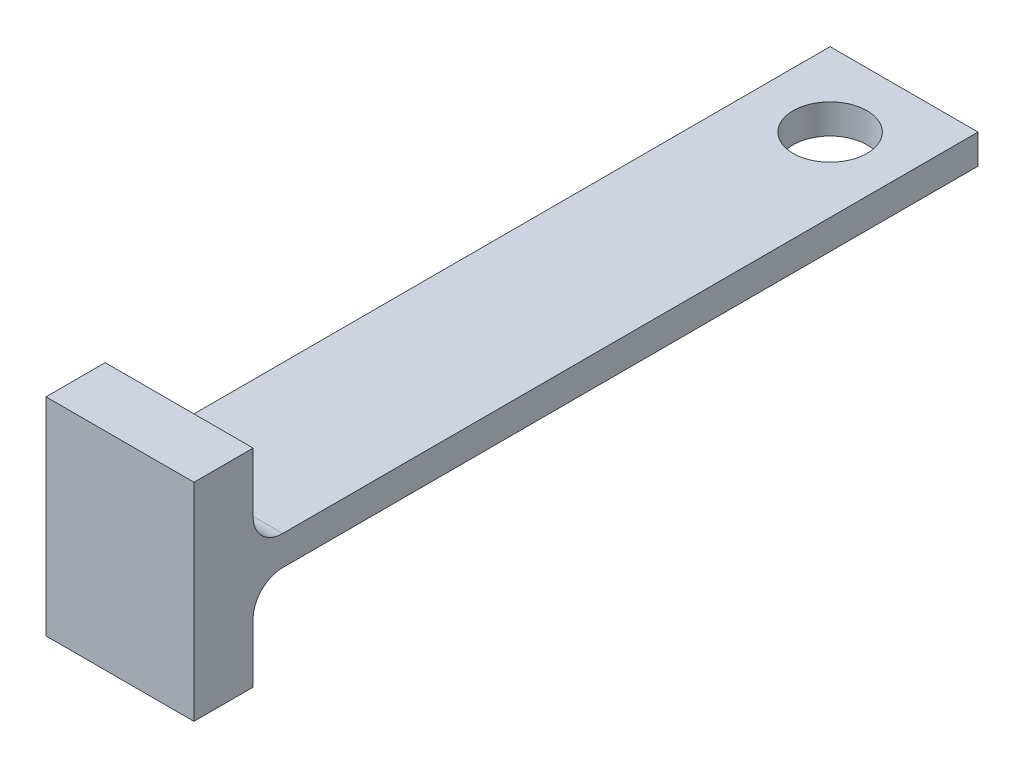
from build123d import *

# Parameters (mm, degrees)
SKETCH1_W           = 50
SKETCH1_H           = 265
SKETCH1_R           = 12.5
BOSS_EXTRUDE1_DEPTH = 10
SKETCH2_W           = 50
SKETCH2_H           = 20
BOSS_EXTRUDE2_DEPTH = 30
SKETCH3_W           = 50
SKETCH3_H           = 20
BOSS_EXTRUDE3_DEPTH = 30
FILLET1_R           = 10


with BuildPart() as part:
    # Sketch1 → Boss-Extrude1 (new body)
    with BuildSketch(Plane(origin=(0, 0, 0), x_dir=(1, 0, 0), z_dir=(0, 1, 0))):
        with Locations((-25, 132.5)):
            Rectangle(SKETCH1_W, SKETCH1_H)
        with Locations(Location((-25, 240, 0), (0, 0, 270))):
            Circle(SKETCH1_R, mode=Mode.SUBTRACT)
    extrude(amount=BOSS_EXTRUDE1_DEPTH)

    # Sketch2 → Boss-Extrude2 (add)
    with BuildSketch(Plane(origin=(0, 10, 0), x_dir=(1, 0, 0), z_dir=(0, 1, 0))):
        with Locations((-25, 10)):
            Rectangle(SKETCH2_W, SKETCH2_H)
    extrude(amount=BOSS_EXTRUDE2_DEPTH)

    # Sketch3 → Boss-Extrude3 (add)
    with BuildSketch(Plane.XZ):
        with Locations((-25, -10)):
            Rectangle(SKETCH3_W, SKETCH3_H)
    extrude(amount=BOSS_EXTRUDE3_DEPTH)

    # Fillet1
    fillet1_edges = [part.edges().sort_by_distance(p)[0] for p in [
        (-25, 10, -20),
        (-25, 0, -20),
    ]]
    fillet(fillet1_edges, radius=FILLET1_R)


solid = part.part
